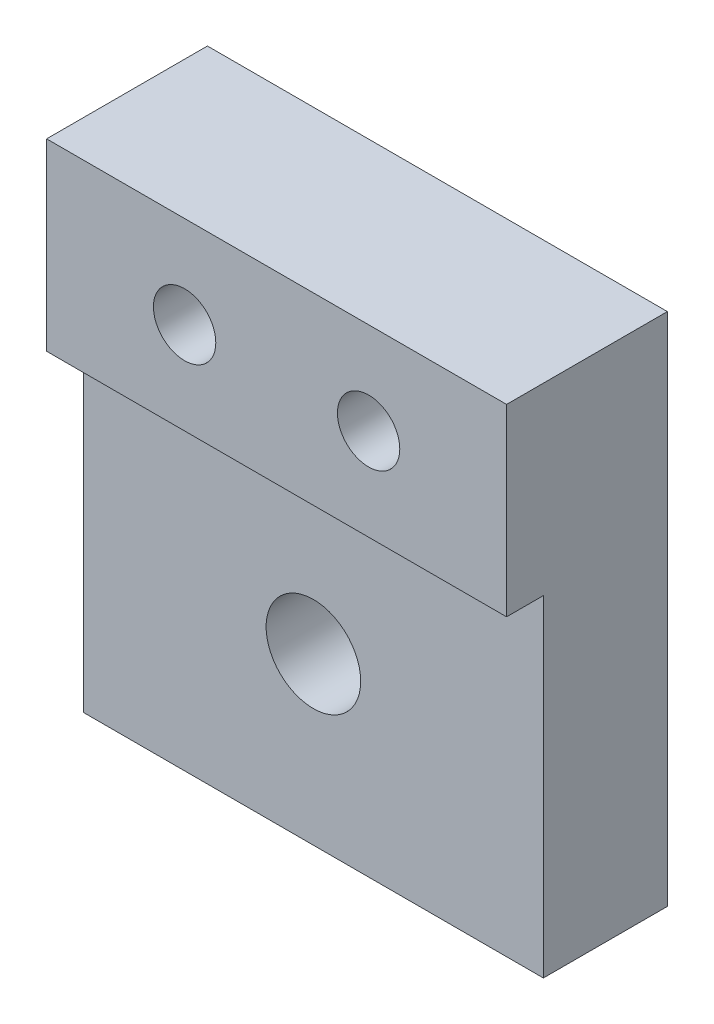
from build123d import *

# Parameters (mm, degrees)
SKETCH1_W           = 31.75
SKETCH1_H           = 12.7
SKETCH1_R           = 2.15265
BOSS_EXTRUDE1_DEPTH = 11.0998
SKETCH1_6_W         = 31.75
SKETCH1_6_H         = 22.86
SKETCH1_6_R         = 3.2639
BOSS_EXTRUDE2_DEPTH = 8.5598


with BuildPart() as part:
    # Sketch1 → Boss-Extrude1 (new body)
    with BuildSketch(Plane.XY):
        with Locations((15.875, 29.21)):
            Rectangle(SKETCH1_W, SKETCH1_H)
        with Locations((9.525, 29.21)):
            Circle(SKETCH1_R, mode=Mode.SUBTRACT)
        with Locations((22.225, 29.21)):
            Circle(SKETCH1_R, mode=Mode.SUBTRACT)
    extrude(amount=BOSS_EXTRUDE1_DEPTH)

    # Sketch1<6> → Boss-Extrude2 (add)
    with BuildSketch(Plane.XY):
        with Locations((15.875, 11.43)):
            Rectangle(SKETCH1_6_W, SKETCH1_6_H)
        with Locations((15.875, 11.43)):
            Circle(SKETCH1_6_R, mode=Mode.SUBTRACT)
    extrude(amount=BOSS_EXTRUDE2_DEPTH)


solid = part.part
